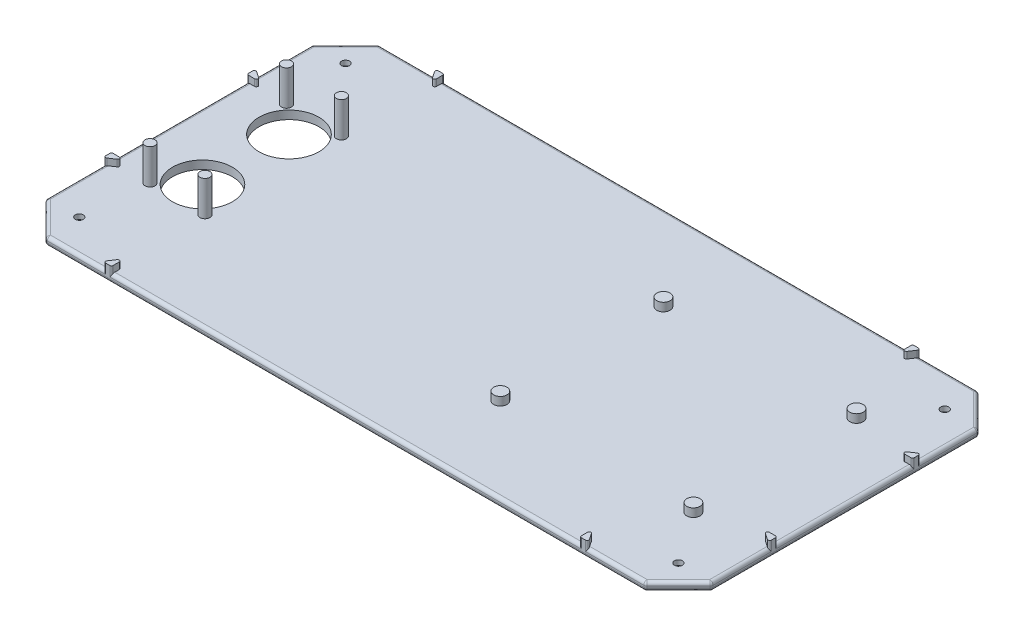
from build123d import *

# Parameters (mm, degrees)
BOSS_EXTRUDE1_DEPTH                             = 2.5
CSK_FOR_M2_FLAT_HEAD_MACHINE_SCREW1_D           = 2.4
CSK_FOR_M2_FLAT_HEAD_MACHINE_SCREW1_CSINK_D     = 4.4
CSK_FOR_M2_FLAT_HEAD_MACHINE_SCREW1_CSINK_ANGLE = 90
SKETCH6_R                                       = 1.5
BOSS_EXTRUDE2_DEPTH                             = 10.5
SKETCH7_R                                       = 9
CUT_EXTRUDE1_DEPTH                              = 10.5
SKETCH8_R                                       = 2
BOSS_EXTRUDE3_DEPTH                             = 2.5
BOSS_EXTRUDE4_DEPTH                             = 2
FILLET1_R                                       = 1
FILLET2_R                                       = 0.5


with BuildPart() as part:
    # Sketch1 → Boss-Extrude1 (new body)
    with BuildSketch(Plane(origin=(0, 0, 0), x_dir=(1, 0, 0), z_dir=(0, 1, 0))):
        Polygon((10, 0), (190, 0), (200, -10), (200, -90), (190, -100), (10, -100), (0, -90), (0, -10), align=None)
    extrude(amount=BOSS_EXTRUDE1_DEPTH)

    # CSK for M2 Flat Head Machine Screw1 (through all)
    with Locations(Plane(origin=(0, 0, 0), x_dir=(-1, 0, 0), z_dir=(0, -1, 0))):
        with Locations((-190, -10), (-190, -90), (-10, -10), (-10, -90)):
            CounterSinkHole(CSK_FOR_M2_FLAT_HEAD_MACHINE_SCREW1_D / 2, CSK_FOR_M2_FLAT_HEAD_MACHINE_SCREW1_CSINK_D / 2, counter_sink_angle=CSK_FOR_M2_FLAT_HEAD_MACHINE_SCREW1_CSINK_ANGLE)

    # Sketch6 → Boss-Extrude2 (add)
    with BuildSketch(Plane(origin=(0, 2.5, 0), x_dir=(1, 0, 0), z_dir=(0, 1, 0))):
        with Locations(Location((11.75, -29.5, 0), (0, 0, 90))):
            Circle(SKETCH6_R)
        with Locations(Location((11.75, -70.5, 0), (0, 0, 90))):
            Circle(SKETCH6_R)
        with Locations(Location((28.25, -70.5, 0), (0, 0, 90))):
            Circle(SKETCH6_R)
        with Locations(Location((28.25, -29.5, 0), (0, 0, 90))):
            Circle(SKETCH6_R)
    extrude(amount=BOSS_EXTRUDE2_DEPTH)

    # Sketch7 → Cut-Extrude1 (cut)
    with BuildSketch(Plane(origin=(0, 2.5, 0), x_dir=(1, 0, 0), z_dir=(0, 1, 0))):
        with Locations(Location((20, -37, 0), (0, 0, 270))):
            Circle(SKETCH7_R)
        with Locations(Location((20, -63, 0), (0, 0, 270))):
            Circle(SKETCH7_R)
    extrude(amount=-CUT_EXTRUDE1_DEPTH, mode=Mode.SUBTRACT)

    # Sketch8 → Boss-Extrude3 (add)
    with BuildSketch(Plane(origin=(0, 2.5, 0), x_dir=(1, 0, 0), z_dir=(0, 1, 0))):
        with Locations(Location((121, -25.5, 0), (0, 0, 90))):
            Circle(SKETCH8_R)
        with Locations(Location((121, -74.5, 0), (0, 0, 90))):
            Circle(SKETCH8_R)
        with Locations(Location((179, -74.5, 0), (0, 0, 90))):
            Circle(SKETCH8_R)
        with Locations(Location((179, -25.5, 0), (0, 0, 90))):
            Circle(SKETCH8_R)
    extrude(amount=BOSS_EXTRUDE3_DEPTH)

    # Sketch9 → Boss-Extrude4 (add)
    with BuildSketch(Plane(origin=(0, 2.5, 0), x_dir=(1, 0, 0), z_dir=(0, 1, 0))):
        Polygon((170.333333333, -96), (173, -100), (170.333333333, -100), align=None)
        Polygon((196, -70.333333333), (200, -73), (200, -70.333333333), align=None)
        Polygon((0, -70.333333333), (0, -73), (4, -70.333333333), align=None)
        Polygon((29.666666667, -100), (27, -100), (29.666666667, -96), align=None)
        Polygon((29.666666667, -4), (27, 0), (29.666666667, 0), align=None)
        Polygon((4, -29.666666667), (0, -27), (0, -29.666666667), align=None)
        Polygon((200, -29.666666667), (200, -27), (196, -29.666666667), align=None)
        Polygon((170.333333333, 0), (173, 0), (170.333333333, -4), align=None)
    extrude(amount=BOSS_EXTRUDE4_DEPTH)

    # Fillet1
    fillet1_edges = [part.edges().sort_by_distance(p)[0] for p in [
        (100, 0, 0),
        (200, 2.5, 50),
        (200, 2.5, 18.5),
        (100, 2.5, 0),
        (18.5, 2.5, 0),
        (0, 2.5, 50),
        (195, 0, 5),
        (0, 2.5, 81.5),
        (100, 2.5, 100),
        (181.5, 2.5, 100),
        (200, 0, 50),
        (195, 0, 95),
        (195, 2.5, 5),
        (190, 1.25, 100),
        (10, 1.25, 100),
        (0, 1.25, 90),
        (0, 1.25, 10),
        (10, 1.25, 0),
        (190, 1.25, 0),
        (200, 1.25, 10),
        (200, 1.25, 90),
        (181.5, 2.5, 0),
        (5, 2.5, 5),
        (0, 2.5, 18.5),
        (5, 2.5, 95),
        (18.5, 2.5, 100),
        (195, 2.5, 95),
        (100, 0, 100),
        (200, 2.5, 81.5),
        (5, 0, 95),
        (0, 0, 50),
        (5, 0, 5),
    ]]
    fillet(fillet1_edges, radius=FILLET1_R)

    # Fillet2
    fillet2_edges = [part.edges().sort_by_distance(p)[0] for p in [
        (29.666666667, 3.5, 96),
        (29.666666667, 3, 100),
        (27, 3, 100),
        (4, 3.5, 70.333333333),
        (0, 3, 73),
        (0, 3, 70.333333333),
        (4, 3.5, 29.666666667),
        (0, 3, 29.666666667),
        (0, 3, 27),
        (29.666666667, 3, 0),
        (27, 3, 0),
        (29.666666667, 3.5, 4),
        (173, 3, 0),
        (170.333333333, 3, 0),
        (170.333333333, 3.5, 4),
        (196, 3.5, 29.666666667),
        (200, 3, 27),
        (200, 3, 29.666666667),
        (196, 3.5, 70.333333333),
        (200, 3, 70.333333333),
        (200, 3, 73),
        (170.333333333, 3.5, 96),
        (170.333333333, 3, 100),
        (173, 3, 100),
    ]]
    fillet(fillet2_edges, radius=FILLET2_R)


solid = part.part
